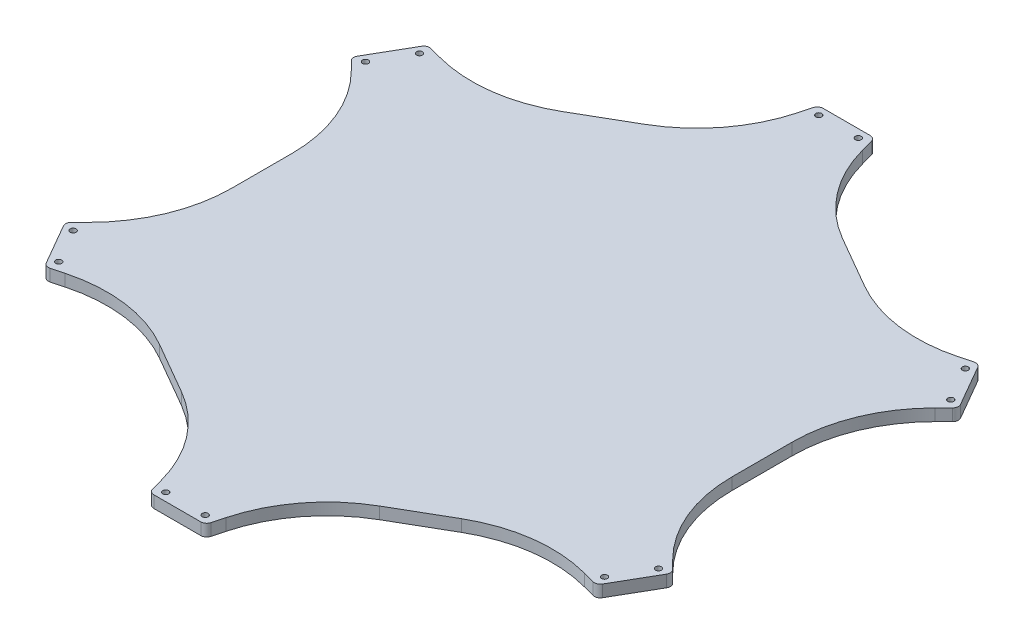
from build123d import *

# Parameters (mm, degrees)
BOSS_EXTRUDE1_DEPTH = 5
SKETCH3_R           = 1.25
CUT_EXTRUDE1_DEPTH  = 215.675530355
CIRPATTERN2_COUNT   = 6
FILLET3_R           = 2.5
FILLET4_R           = 60


with BuildPart() as part:
    # Sketch1 → Boss-Extrude1 (new body)
    with BuildSketch(Plane(origin=(0, 0, 0), x_dir=(1, 0, 0), z_dir=(0, 1, 0))):
        Polygon((-81.117712821, 140.5), (-162.235425642, 0), (-81.117712821, -140.5), (81.117712821, -140.5), (162.235425642, 0), (81.117712821, 140.5), align=None)
    extrude(amount=BOSS_EXTRUDE1_DEPTH)

    # Sketch3 → Cut-Extrude1 (cut, through all)
    with BuildSketch(Plane(origin=(0, 5, 0), x_dir=(1, 0, 0), z_dir=(0, 1, 0))):
        with Locations((8.3, 137.1)):
            Circle(SKETCH3_R)
        with Locations((-8.3, 137.1)):
            Circle(SKETCH3_R)
        Polygon((11.75, 140.5), (20.012731221, 109.663067273), (84.964636505, 72.163067273), (115.801569232, 80.425798494), (81.117712821, 140.5), align=None)
    cut_extrude1 = extrude(amount=-CUT_EXTRUDE1_DEPTH, mode=Mode.SUBTRACT)

    # CirPattern2: Cut-Extrude1 ×6 about axis
    cirpattern2_axis = Axis((0, 0, 0), (0, 1, 0))
    for i in range(1, CIRPATTERN2_COUNT):
        add(cut_extrude1.rotate(cirpattern2_axis, i * 360 / CIRPATTERN2_COUNT), mode=Mode.SUBTRACT)

    # Fillet3
    fillet3_edges = [part.edges().sort_by_distance(p)[0] for p in [
        (115.801569232, 2.5, -80.425798494),
        (11.75, 2.5, -140.5),
        (127.551569232, 2.5, -60.074201506),
        (127.551569232, 2.5, 60.074201506),
        (115.801569232, 2.5, 80.425798494),
        (11.75, 2.5, 140.5),
        (-11.75, 2.5, 140.5),
        (-115.801569232, 2.5, 80.425798494),
        (-127.551569232, 2.5, 60.074201506),
        (-127.551569232, 2.5, -60.074201506),
        (-115.801569232, 2.5, -80.425798494),
        (-11.75, 2.5, -140.5),
    ]]
    fillet(fillet3_edges, radius=FILLET3_R)

    # Fillet4
    fillet4_edges = [part.edges().sort_by_distance(p)[0] for p in [
        (84.964636505, 2.5, -72.163067273),
        (20.012731221, 2.5, -109.663067273),
        (-20.012731221, 2.5, -109.663067273),
        (-84.964636505, 2.5, -72.163067273),
        (-104.977367726, 2.5, -37.5),
        (-104.977367726, 2.5, 37.5),
        (-84.964636505, 2.5, 72.163067273),
        (-20.012731221, 2.5, 109.663067273),
        (20.012731221, 2.5, 109.663067273),
        (84.964636505, 2.5, 72.163067273),
        (104.977367726, 2.5, 37.5),
        (104.977367726, 2.5, -37.5),
    ]]
    fillet(fillet4_edges, radius=FILLET4_R)


solid = part.part
